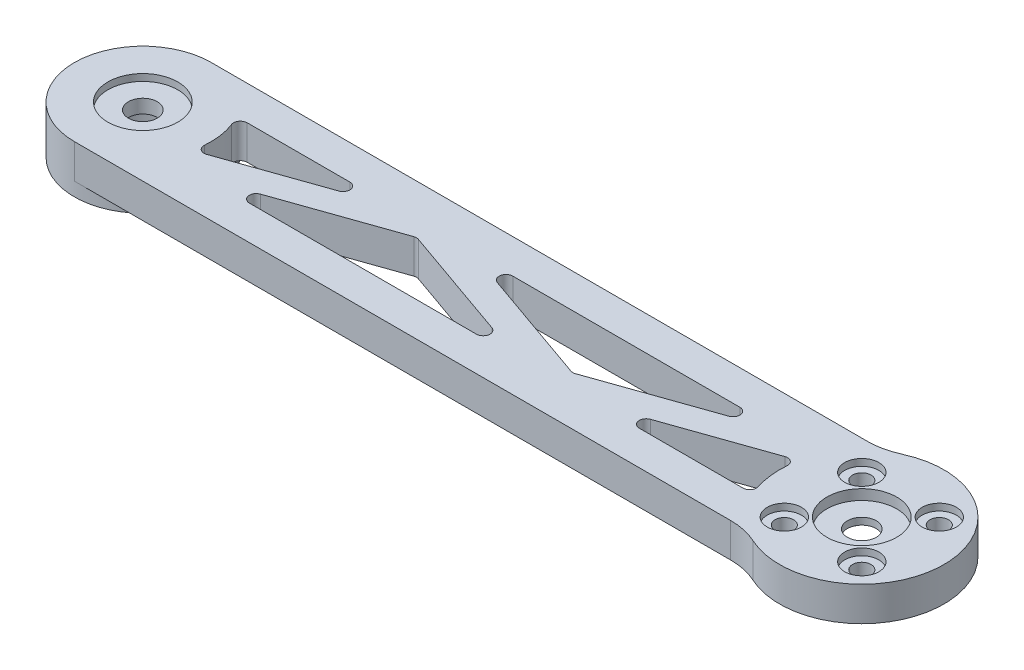
from build123d import *
from build123d.topology import SkipClean

# Parameters (mm, degrees)
SKETCH_1_R            = 1.35
SKETCH_1_R_2          = 5.1
SKETCH_1_R_3          = 6.1
EXTRUDE_1_DEPTH       = 5
EXTRUDE_START         = 1.5
SKETCH_1_4_R          = 6.1
SKETCH_1_4_R_2        = 5.1
SKETCH_1_4_R_3        = 2.1
EXTRUDE_3_DEPTH       = 2
FILLET_1_R            = 1
FILLET_2_R            = 1
FILLET_3_R            = 1
FILLET_4_R            = 1
FILLET_5_R            = 10
SKETCH_1_9_R          = 1.35
SKETCH_1_9_R_2        = 6.1
SKETCH_1_9_R_3        = 2.1
EXTRUDE_4_DEPTH       = 4
EXTRUDE_START_2       = 2
SKETCH_1_10_R         = 6.1
SKETCH_1_10_R_2       = 2.1
EXTRUDE_5_DEPTH       = 2
SKETCH_1_11_R         = 6.1
SKETCH_1_11_R_2       = 5.1
EXTRUDE_7_DEPTH       = 3.5
CUT_EXTRUDE_START     = 5
SKETCH_1_15_R         = 2.5
SKETCH_1_15_R_2       = 1.35
CUT_EXTRUDE_1_DEPTH   = 1
SKETCH_2_R            = 10
SKETCH_2_R_2          = 6.1
EXTRUDE_8_DEPTH       = 2
SKETCH_1_16_R         = 6.1
SKETCH_1_16_R_2       = 5.1
CUT_EXTRUDE_1_2_DEPTH = 1.5
SKETCH_3_R            = 6.1
SKETCH_3_R_2          = 5.1
EXTRUDE_9_DEPTH       = 1
CUT_EXTRUDE_2_DEPTH   = 1


with BuildPart() as part:
    # 草图1 → 凸台-拉伸1 (new body)
    with BuildSketch(Plane(origin=(0, 0, 0), x_dir=(1, 0, 0), z_dir=(0, 1, 0))):
        with BuildLine():
            Line((-105, 10), (-6.633249581, 10))
            ThreePointArc((-6.633249581, 10), (12, 0), (-6.633249581, -10))
            Line((-6.633249581, -10), (-105, -10))
            ThreePointArc((-105, -10), (-115, 0), (-105, 10))
        make_face()
        with Locations(Location((-5.656854249, 5.656854249, 0), (0, 0, 270))):
            Circle(SKETCH_1_R, mode=Mode.SUBTRACT)
        with Locations(Location((5.656854249, 5.656854249, 0), (0, 0, 270))):
            Circle(SKETCH_1_R, mode=Mode.SUBTRACT)
        with Locations(Location((5.656854249, -5.656854249, 0), (0, 0, 270))):
            Circle(SKETCH_1_R, mode=Mode.SUBTRACT)
        with Locations(Location((-5.656854249, -5.656854249, 0), (0, 0, 270))):
            Circle(SKETCH_1_R, mode=Mode.SUBTRACT)
        with Locations(Location((0, 0, 0), (0, 0, 270))):
            Circle(SKETCH_1_R_2, mode=Mode.SUBTRACT)
        with Locations(Location((-105, 0, 0), (0, 0, 270))):
            Circle(SKETCH_1_R_3, mode=Mode.SUBTRACT)
        Polygon((-90.303388877, -5), (-45.422080483, -5), (-67.86273468, 2.88027015), align=None, mode=Mode.SUBTRACT)
        with BuildLine():
            Line((-96.339745962, 5), (-73.899091765, 5))
            Line((-73.899091765, 5), (-95.323626495, -2.523449184))
            ThreePointArc((-95.323626495, -2.523449184), (-95.08997733, 1.33845085), (-96.339745962, 5))
        make_face(mode=Mode.SUBTRACT)
        Polygon((-61.826377594, 5), (-39.385723397, -2.88027015), (-16.9450692, 5), align=None, mode=Mode.SUBTRACT)
        with BuildLine():
            Line((-33.349366312, -5), (-11.715632737, 2.596911544))
            ThreePointArc((-11.715632737, 2.596911544), (-11.93287523, -1.267473374), (-10.908712115, -5))
            Line((-10.908712115, -5), (-33.349366312, -5))
        make_face(mode=Mode.SUBTRACT)
    extrude(amount=EXTRUDE_1_DEPTH)

    # 草图1<4> → 凸台-拉伸3 (add)
    # profile 1 of 2: a face of its own
    with BuildSketch(Plane(origin=(0, 0, 0), x_dir=(1, 0, 0), z_dir=(0, 1, 0)).offset(EXTRUDE_START)):
        Circle(SKETCH_1_4_R)
        with Locations(Location((0, 0, 0), (0, 0, 270))):
            Circle(SKETCH_1_4_R_2, mode=Mode.SUBTRACT)
    # profile 2 of 2: a face of its own
    with BuildSketch(Plane(origin=(0, 0, 0), x_dir=(1, 0, 0), z_dir=(0, 1, 0)).offset(EXTRUDE_START)):
        with Locations(Location((0, 0, 0), (0, 0, 270))):
            Circle(SKETCH_1_4_R_2)
        with Locations(Location((0, 0, 0), (0, 0, 270))):
            Circle(SKETCH_1_4_R_3, mode=Mode.SUBTRACT)
    extrude(amount=EXTRUDE_3_DEPTH)

    # 圆角1
    fillet_1_edges = [part.edges().sort_by_distance(p)[0] for p in [
        (-73.899091765, 2.5, -5),
        (-96.339745962, 2.5, -5),
        (-95.323626495, 2.5, 2.523449184),
    ]]
    fillet(fillet_1_edges, radius=FILLET_1_R)

    # 圆角2
    fillet_2_edges = [part.edges().sort_by_distance(p)[0] for p in [
        (-90.303388877, 2.5, 5),
        (-45.422080483, 2.5, 5),
        (-67.86273468, 2.5, -2.88027015),
    ]]
    fillet(fillet_2_edges, radius=FILLET_2_R)

    # 圆角3
    fillet_3_edges = [part.edges().sort_by_distance(p)[0] for p in [
        (-39.385723397, 2.5, 2.88027015),
        (-16.9450692, 2.5, -5),
        (-61.826377594, 2.5, -5),
    ]]
    fillet(fillet_3_edges, radius=FILLET_3_R)

    # 圆角4
    fillet_4_edges = [part.edges().sort_by_distance(p)[0] for p in [
        (-33.349366312, 2.5, 5),
        (-10.908712115, 2.5, 5),
        (-11.715632737, 2.5, -2.596911544),
    ]]
    fillet(fillet_4_edges, radius=FILLET_4_R)

    # 圆角5
    fillet_5_edges = [part.edges().sort_by_distance(p)[0] for p in [
        (-6.633249581, 2.5, -10),
        (-6.633249581, 2.5, 10),
    ]]
    fillet(fillet_5_edges, radius=FILLET_5_R)

    # 草图1<9> → 凸台-拉伸4 (add)
    # profile 1 of 2: a face of its own
    with BuildSketch(Plane(origin=(0, 0, 0), x_dir=(1, 0, 0), z_dir=(0, 1, 0))):
        with BuildLine():
            Line((-105, 10), (-6.633249581, 10))
            ThreePointArc((-6.633249581, 10), (12, 0), (-6.633249581, -10))
            Line((-6.633249581, -10), (-105, -10))
            ThreePointArc((-105, -10), (-115, 0), (-105, 10))
        make_face()
        with Locations(Location((-5.656854249, 5.656854249, 0), (0, 0, 270))):
            Circle(SKETCH_1_9_R, mode=Mode.SUBTRACT)
        with Locations(Location((5.656854249, 5.656854249, 0), (0, 0, 270))):
            Circle(SKETCH_1_9_R, mode=Mode.SUBTRACT)
        with Locations(Location((5.656854249, -5.656854249, 0), (0, 0, 270))):
            Circle(SKETCH_1_9_R, mode=Mode.SUBTRACT)
        with Locations(Location((-5.656854249, -5.656854249, 0), (0, 0, 270))):
            Circle(SKETCH_1_9_R, mode=Mode.SUBTRACT)
        with Locations(Location((-105, 0, 0), (0, 0, 270))):
            Circle(SKETCH_1_9_R_2, mode=Mode.SUBTRACT)
        Circle(SKETCH_1_9_R_2, mode=Mode.SUBTRACT)
        Polygon((-90.303388877, -5), (-45.422080483, -5), (-67.86273468, 2.88027015), align=None, mode=Mode.SUBTRACT)
        with BuildLine():
            Line((-96.339745962, 5), (-73.899091765, 5))
            Line((-73.899091765, 5), (-95.323626495, -2.523449184))
            ThreePointArc((-95.323626495, -2.523449184), (-95.08997733, 1.33845085), (-96.339745962, 5))
        make_face(mode=Mode.SUBTRACT)
        Polygon((-61.826377594, 5), (-39.385723397, -2.88027015), (-16.9450692, 5), align=None, mode=Mode.SUBTRACT)
        with BuildLine():
            Line((-33.349366312, -5), (-11.715632737, 2.596911544))
            ThreePointArc((-11.715632737, 2.596911544), (-11.93287523, -1.267473374), (-10.908712115, -5))
            Line((-10.908712115, -5), (-33.349366312, -5))
        make_face(mode=Mode.SUBTRACT)
    # profile 2 of 2: a face of its own
    with BuildSketch(Plane(origin=(0, 0, 0), x_dir=(1, 0, 0), z_dir=(0, 1, 0))):
        with Locations((-105, 0)):
            Circle(SKETCH_1_9_R_3)
    extrude(amount=EXTRUDE_4_DEPTH)


with BuildPart() as extrude_4_kept_piece:
    # of the separate pieces the step leaves, the one the design keeps (extrude_4_pieces_kept)
    add(part.part.solids().sort_by_distance((-9.16515139, 0, 10))[0])

    # 草图1<10> → 凸台-拉伸5 (add)
    with BuildSketch(Plane(origin=(0, 0, 0), x_dir=(1, 0, 0), z_dir=(0, 1, 0)).offset(EXTRUDE_START_2)):
        with Locations(Location((-105, 0, 0), (0, 0, 270))):
            Circle(SKETCH_1_10_R)
        with Locations(Location((-105, 0, 0), (0, 0, 270))):
            Circle(SKETCH_1_10_R_2, mode=Mode.SUBTRACT)
    extrude(amount=EXTRUDE_5_DEPTH)

    # 草图1<11> → 凸台-拉伸7 (add)
    with BuildSketch(Plane(origin=(0, 0, 0), x_dir=(1, 0, 0), z_dir=(0, 1, 0))):
        Circle(SKETCH_1_11_R)
        with Locations(Location((0, 0, 0), (0, 0, 270))):
            Circle(SKETCH_1_11_R_2, mode=Mode.SUBTRACT)
    extrude(amount=EXTRUDE_7_DEPTH)

    # 草图1<15> → Cut-Extrude 1 (cut)
    # profile 1 of 4: a face of its own
    with BuildSketch(Plane(origin=(0, 0, 0), x_dir=(1, 0, 0), z_dir=(0, 1, 0)).offset(CUT_EXTRUDE_START)):
        with Locations((-5.656854249, 5.656854249)):
            Circle(SKETCH_1_15_R)
        with Locations((-5.656854249, 5.656854249)):
            Circle(SKETCH_1_15_R_2, mode=Mode.SUBTRACT)
    # profile 2 of 4: a face of its own
    with BuildSketch(Plane(origin=(0, 0, 0), x_dir=(1, 0, 0), z_dir=(0, 1, 0)).offset(CUT_EXTRUDE_START)):
        with Locations((5.656854249, 5.656854249)):
            Circle(SKETCH_1_15_R)
        with Locations((5.656854249, 5.656854249)):
            Circle(SKETCH_1_15_R_2, mode=Mode.SUBTRACT)
    # profile 3 of 4: a face of its own
    with BuildSketch(Plane(origin=(0, 0, 0), x_dir=(1, 0, 0), z_dir=(0, 1, 0)).offset(CUT_EXTRUDE_START)):
        with Locations((5.656854249, -5.656854249)):
            Circle(SKETCH_1_15_R)
        with Locations((5.656854249, -5.656854249)):
            Circle(SKETCH_1_15_R_2, mode=Mode.SUBTRACT)
    # profile 4 of 4: a face of its own
    with BuildSketch(Plane(origin=(0, 0, 0), x_dir=(1, 0, 0), z_dir=(0, 1, 0)).offset(CUT_EXTRUDE_START)):
        with Locations((-5.656854249, -5.656854249)):
            Circle(SKETCH_1_15_R)
        with Locations((-5.656854249, -5.656854249)):
            Circle(SKETCH_1_15_R_2, mode=Mode.SUBTRACT)
    extrude(amount=-CUT_EXTRUDE_1_DEPTH, mode=Mode.SUBTRACT)

    # 草图2 → 凸台-拉伸8 (add)
    with SkipClean():  # the faces are left unmerged after this step: merging them gives an invalid solid
        with BuildSketch(Plane.XZ):
            with Locations(Location((-105, 0, 0), (0, 0, 270))):
                Circle(SKETCH_2_R)
            with Locations(Location((-105, 0, 0), (0, 0, 270))):
                Circle(SKETCH_2_R_2, mode=Mode.SUBTRACT)
        extrude(amount=EXTRUDE_8_DEPTH)

    # 草图1<16> → Cut-Extrude 1 2 (cut)
    with SkipClean():  # the faces are left unmerged after this step: merging them gives an invalid solid
        with BuildSketch(Plane(origin=(0, 0, 0), x_dir=(1, 0, 0), z_dir=(0, 1, 0))):
            with Locations(Location((0, 0, 0), (0, 0, 270))):
                Circle(SKETCH_1_16_R)
            with Locations(Location((0, 0, 0), (0, 0, 270))):
                Circle(SKETCH_1_16_R_2, mode=Mode.SUBTRACT)
        extrude(amount=CUT_EXTRUDE_1_2_DEPTH, mode=Mode.SUBTRACT)

    # 草图3 → 凸台-拉伸9 (add)
    with SkipClean():  # the faces are left unmerged after this step: merging them gives an invalid solid
        with BuildSketch(Plane(origin=(0, 5, 0), x_dir=(1, 0, 0), z_dir=(0, 1, 0))):
            with Locations(Location((-105, 0, 0), (0, 0, 90))):
                Circle(SKETCH_3_R)
            with Locations(Location((-105, 0, 0), (0, 0, 270))):
                Circle(SKETCH_3_R_2, mode=Mode.SUBTRACT)
        extrude(amount=-EXTRUDE_9_DEPTH)

    # 草图4 → 切除-拉伸2 (cut)
    with SkipClean():  # the faces are left unmerged after this step: merging them gives an invalid solid
        with BuildSketch(Plane.XZ.offset(-1.5)):
            Polygon((3.983716857, 0), (1.991858429, 3.45), (-1.991858429, 3.45), (-3.983716857, 0), (-1.991858429, -3.45), (1.991858429, -3.45), align=None)
        extrude(amount=-CUT_EXTRUDE_2_DEPTH, mode=Mode.SUBTRACT)


solid = extrude_4_kept_piece.part
